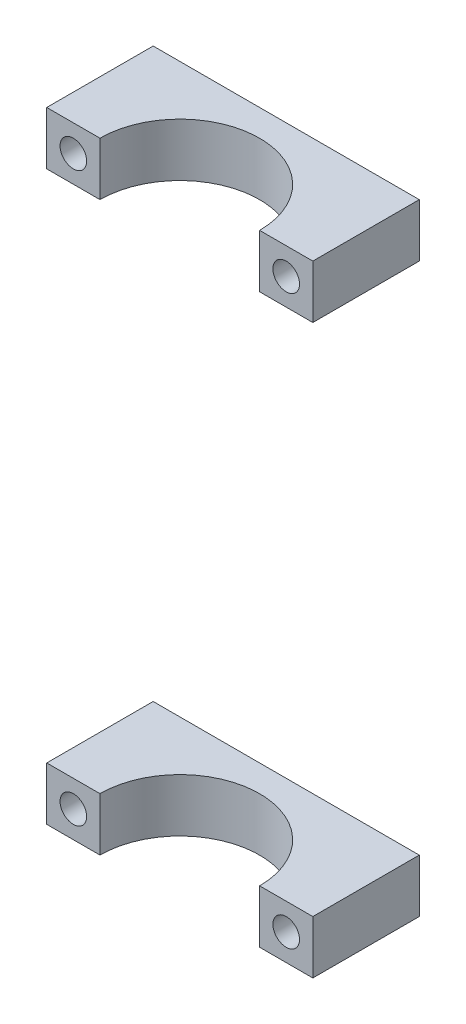
from build123d import *

# Parameters (mm, degrees)
SKETCH1_W               = 50
SKETCH1_H               = 100
BOSS_EXTRUDE1_DEPTH     = 30
SKETCH2_W               = 42
SKETCH2_H               = 92
CUT_EXTRUDE1_DEPTH      = 26
SKETCH3_W               = 30
SKETCH3_H               = 6
BOSS_EXTRUDE2_DEPTH     = 24
CUT_EXTRUDE2_DEPTH      = 104.07764064
CUT_EXTRUDE2_DEPTH_BACK = 104.07764064
SKETCH4_R               = 9
CUT_EXTRUDE3_DEPTH      = 125.161185561
CUT_EXTRUDE3_DEPTH_BACK = 125.161185561
SKETCH5_R               = 1.5
CUT_EXTRUDE4_DEPTH      = 116.758369028
CUT_EXTRUDE4_DEPTH_BACK = 116.758369028
SKETCH6_W               = 50
SKETCH6_H               = 42


with BuildPart() as part:
    # Sketch1 → Boss-Extrude1 (new body)
    with BuildSketch(Plane.XY):
        with Locations((25, 50)):
            Rectangle(SKETCH1_W, SKETCH1_H)
    extrude(amount=BOSS_EXTRUDE1_DEPTH)

    # Sketch2 → Cut-Extrude1 (cut)
    with BuildSketch(Plane.XY.offset(30)):
        with Locations((25, 50)):
            Rectangle(SKETCH2_W, SKETCH2_H)
    extrude(amount=-CUT_EXTRUDE1_DEPTH, mode=Mode.SUBTRACT)

    # Sketch3 → Boss-Extrude2 (add)
    with BuildSketch(Plane(origin=(0, 0, 0), x_dir=(-1, 0, 0), z_dir=(0, 0, -1))):
        with Locations((-25, 18)):
            Rectangle(SKETCH3_W, SKETCH3_H)
        with Locations((-25, 82)):
            Rectangle(SKETCH3_W, SKETCH3_H)
    extrude(amount=BOSS_EXTRUDE2_DEPTH)

    # Sketch4 → Cut-Extrude2 (cut, two sides: drawn at the far end of the back side and taken through both)
    with BuildSketch(Plane.XZ.offset(-15).offset(-CUT_EXTRUDE2_DEPTH_BACK)):
        with Locations((25, -12)):
            Circle(SKETCH4_R)
    extrude(amount=CUT_EXTRUDE2_DEPTH + CUT_EXTRUDE2_DEPTH_BACK, mode=Mode.SUBTRACT)

    # Sketch5 → Cut-Extrude3 (cut, two sides: drawn at the far end of the back side and taken through both)
    with BuildSketch(Plane(origin=(0, 0, -24), x_dir=(-1, 0, 0), z_dir=(0, 0, -1)).offset(-CUT_EXTRUDE3_DEPTH_BACK)):
        with Locations((-13, 18)):
            Circle(SKETCH5_R)
        with Locations((-37, 18)):
            Circle(SKETCH5_R)
        with Locations((-13, 82)):
            Circle(SKETCH5_R)
        with Locations((-37, 82)):
            Circle(SKETCH5_R)
    extrude(amount=CUT_EXTRUDE3_DEPTH + CUT_EXTRUDE3_DEPTH_BACK, mode=Mode.SUBTRACT)

    # Sketch6 → Cut-Extrude4 (cut, two sides: drawn at the far end of the back side and taken through both)
    with BuildSketch(Plane.XZ.offset(-CUT_EXTRUDE4_DEPTH_BACK)):
        with Locations((25, 9)):
            Rectangle(SKETCH6_W, SKETCH6_H)
    extrude(amount=CUT_EXTRUDE4_DEPTH + CUT_EXTRUDE4_DEPTH_BACK, mode=Mode.SUBTRACT)


with BuildPart() as cut_extrude4_piece_1:
    # of the separate pieces the step leaves, piece 1, a body of its own (cut_extrude4_pieces)
    add(part.part.solids().sort_by_distance((40, 21, -12))[0])


with BuildPart() as cut_extrude4_piece_2:
    # of the separate pieces the step leaves, piece 2, a body of its own (cut_extrude4_pieces)
    add(part.part.solids().sort_by_distance((40, 85, -12))[0])


solid = Compound([cut_extrude4_piece_1.part, cut_extrude4_piece_2.part])
